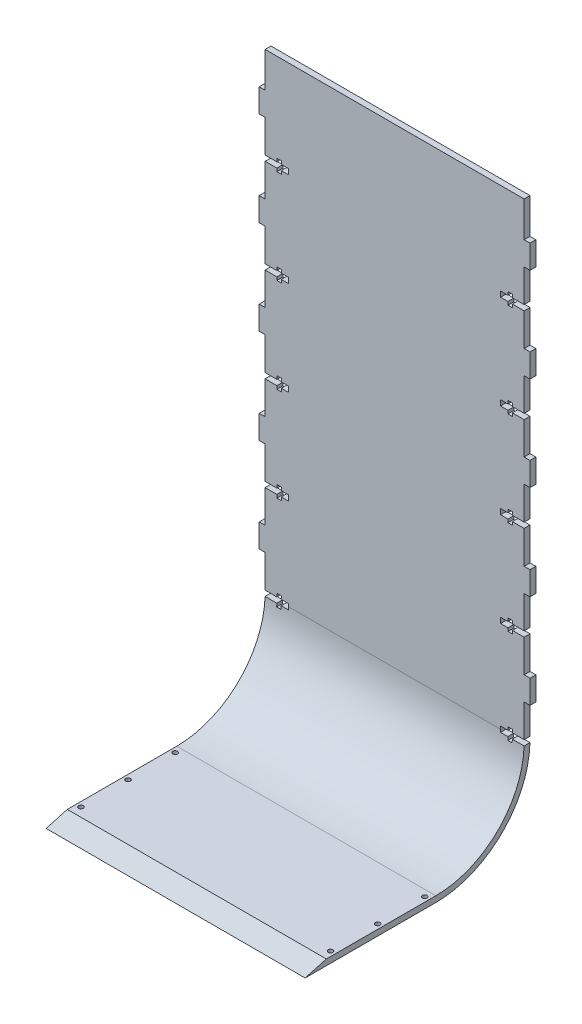
from build123d import *

# Parameters (mm, degrees)
BOSS_EXTRUDE1_DEPTH = 139.7
CUT_EXTRUDE1_DEPTH  = 3.175
SKETCH5_W           = 3.175
SKETCH5_H           = 12.7
BOSS_EXTRUDE2_DEPTH = 3.175
SKETCH8_R           = 1.27
CUT_EXTRUDE2_DEPTH  = 3.175


with BuildPart() as part:
    # Sketch1 → Boss-Extrude1 (new body)
    with BuildSketch(Plane(origin=(0, 0, 0), x_dir=(0, 0, -1), z_dir=(1, 0, 0))):
        with BuildLine():
            Line((-118.11, -50.8), (-106.68, -47.625))
            Line((-106.68, -47.625), (-47.625, -47.625))
            ThreePointArc((-47.625, -47.625), (-13.949039546, -33.675960454), (0, 0))
            Line((0, 0), (0, 254))
            Line((0, 254), (3.175, 254))
            Line((3.175, 254), (3.175, 0))
            ThreePointArc((3.175, 0), (-11.703975516, -35.921024484), (-47.625, -50.8))
            Line((-47.625, -50.8), (-118.11, -50.8))
        make_face()
    extrude(amount=BOSS_EXTRUDE1_DEPTH)

    # Sketch4 → Cut-Extrude1 (cut, symmetric)
    with BuildSketch(Plane.XY):
        Polygon((0, 204.6605), (0, 201.7395), (6.35, 201.7395), (6.35, 200.025), (8.73125, 200.025), (8.73125, 201.7395), (12.7, 201.7395), (12.7, 203.2), (12.7, 204.6605), (8.73125, 204.6605), (8.73125, 206.375), (6.35, 206.375), (6.35, 204.6605), align=None)
        Polygon((0, 153.8605), (0, 150.9395), (6.35, 150.9395), (6.35, 149.225), (8.73125, 149.225), (8.73125, 150.9395), (12.7, 150.9395), (12.7, 152.4), (12.7, 153.8605), (8.73125, 153.8605), (8.73125, 155.575), (6.35, 155.575), (6.35, 153.8605), align=None)
        Polygon((0, 103.0605), (0, 100.1395), (6.35, 100.1395), (6.35, 98.425), (8.73125, 98.425), (8.73125, 100.1395), (12.7, 100.1395), (12.7, 101.6), (12.7, 103.0605), (8.73125, 103.0605), (8.73125, 104.775), (6.35, 104.775), (6.35, 103.0605), align=None)
        Polygon((0, 52.2605), (0, 49.3395), (6.35, 49.3395), (6.35, 47.625), (8.73125, 47.625), (8.73125, 49.3395), (12.7, 49.3395), (12.7, 50.8), (12.7, 52.2605), (8.73125, 52.2605), (8.73125, 53.975), (6.35, 53.975), (6.35, 52.2605), align=None)
        Polygon((0, 1.4605), (0, -1.4605), (6.35, -1.4605), (6.35, -3.175), (8.73125, -3.175), (8.73125, -1.4605), (12.7, -1.4605), (12.7, 0), (12.7, 1.4605), (8.73125, 1.4605), (8.73125, 3.175), (6.35, 3.175), (6.35, 1.4605), align=None)
    cut_extrude1 = extrude(amount=CUT_EXTRUDE1_DEPTH, both=True, mode=Mode.SUBTRACT)

    # Sketch5 → Boss-Extrude2 (add)
    with BuildSketch(Plane.XY):
        with Locations((-1.5875, 228.6)):
            Rectangle(SKETCH5_W, SKETCH5_H)
        with Locations((-1.5875, 177.8)):
            Rectangle(SKETCH5_W, SKETCH5_H)
        with Locations((-1.5875, 25.4)):
            Rectangle(SKETCH5_W, SKETCH5_H)
        with Locations((-1.5875, 76.085444403)):
            Rectangle(SKETCH5_W, SKETCH5_H)
        with Locations((-1.5875, 127.114555597)):
            Rectangle(SKETCH5_W, SKETCH5_H)
    boss_extrude2 = extrude(amount=-BOSS_EXTRUDE2_DEPTH)

    # Mirror1: Cut-Extrude1, Boss-Extrude2 across plane
    add(cut_extrude1.mirror(Plane(origin=(69.85, 0, 0), x_dir=(0, 0, 1), z_dir=(1, 0, 0))), mode=Mode.SUBTRACT)
    add(boss_extrude2.mirror(Plane(origin=(69.85, 0, 0), x_dir=(0, 0, 1), z_dir=(1, 0, 0))))

    # Sketch8 → Cut-Extrude2 (cut)
    with BuildSketch(Plane(origin=(0, -47.625, 0), x_dir=(1, 0, 0), z_dir=(0, 1, 0))):
        with Locations((2.54, -51.054)):
            Circle(SKETCH8_R)
        with Locations((2.54, -76.454)):
            Circle(SKETCH8_R)
        with Locations((2.54, -101.854)):
            Circle(SKETCH8_R)
    cut_extrude2 = extrude(amount=-CUT_EXTRUDE2_DEPTH, mode=Mode.SUBTRACT)

    # Mirror2: Cut-Extrude2 across plane
    add(cut_extrude2.mirror(Plane(origin=(69.85, 0, 0), x_dir=(0, 0, 1), z_dir=(1, 0, 0))), mode=Mode.SUBTRACT)


solid = part.part
